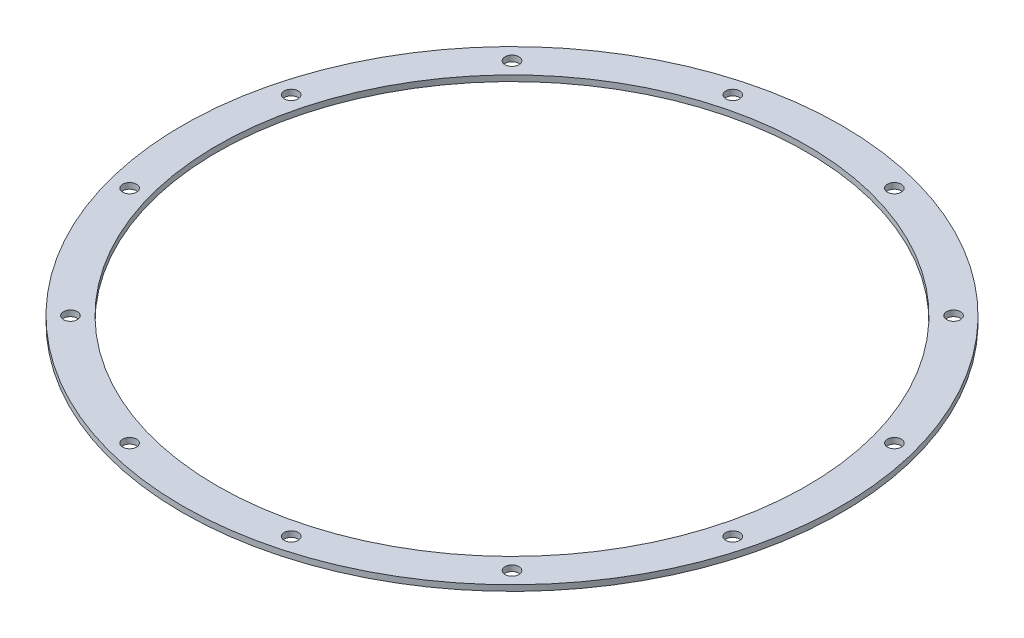
from build123d import *

# Parameters (mm, degrees)
SCHIZZO1_R                   = 255
SCHIZZO1_R_2                 = 6
ESTRUSIONE_ESTRUSIONE1_DEPTH = 2.5


with BuildPart() as part:
    # Schizzo1 → Estrusione-Estrusione1 (new, symmetric)
    with BuildSketch(Plane(origin=(0, 0, 0), x_dir=(1, 0, 0), z_dir=(0, 1, 0))):
        with BuildLine():
            ThreePointArc((-285, 0), (0, -285), (285, 0))
            ThreePointArc((285, 0), (0, 285), (-285, 0))
        make_face()
        with Locations(Location((0, 0, 0), (0, 0, 270))):
            Circle(SCHIZZO1_R, mode=Mode.SUBTRACT)
        with Locations(Location((-260.799973098, 69.881142178, 0), (0, 0, 270))):
            Circle(SCHIZZO1_R_2, mode=Mode.SUBTRACT)
        with Locations(Location((-190.91883092, 190.91883092, 0), (0, 0, 270))):
            Circle(SCHIZZO1_R_2, mode=Mode.SUBTRACT)
        with Locations(Location((-69.881142178, 260.799973098, 0), (0, 0, 270))):
            Circle(SCHIZZO1_R_2, mode=Mode.SUBTRACT)
        with Locations(Location((69.881142178, 260.799973098, 0), (0, 0, 270))):
            Circle(SCHIZZO1_R_2, mode=Mode.SUBTRACT)
        with Locations(Location((190.91883092, 190.91883092, 0), (0, 0, 270))):
            Circle(SCHIZZO1_R_2, mode=Mode.SUBTRACT)
        with Locations(Location((260.799973098, 69.881142178, 0), (0, 0, 270))):
            Circle(SCHIZZO1_R_2, mode=Mode.SUBTRACT)
        with Locations(Location((260.799973098, -69.881142178, 0), (0, 0, 270))):
            Circle(SCHIZZO1_R_2, mode=Mode.SUBTRACT)
        with Locations(Location((190.91883092, -190.91883092, 0), (0, 0, 270))):
            Circle(SCHIZZO1_R_2, mode=Mode.SUBTRACT)
        with Locations(Location((69.881142178, -260.799973098, 0), (0, 0, 270))):
            Circle(SCHIZZO1_R_2, mode=Mode.SUBTRACT)
        with Locations(Location((-69.881142178, -260.799973098, 0), (0, 0, 270))):
            Circle(SCHIZZO1_R_2, mode=Mode.SUBTRACT)
        with Locations(Location((-190.91883092, -190.91883092, 0), (0, 0, 270))):
            Circle(SCHIZZO1_R_2, mode=Mode.SUBTRACT)
        with Locations(Location((-260.799973098, -69.881142178, 0), (0, 0, 270))):
            Circle(SCHIZZO1_R_2, mode=Mode.SUBTRACT)
    extrude(amount=ESTRUSIONE_ESTRUSIONE1_DEPTH, both=True)


solid = part.part
